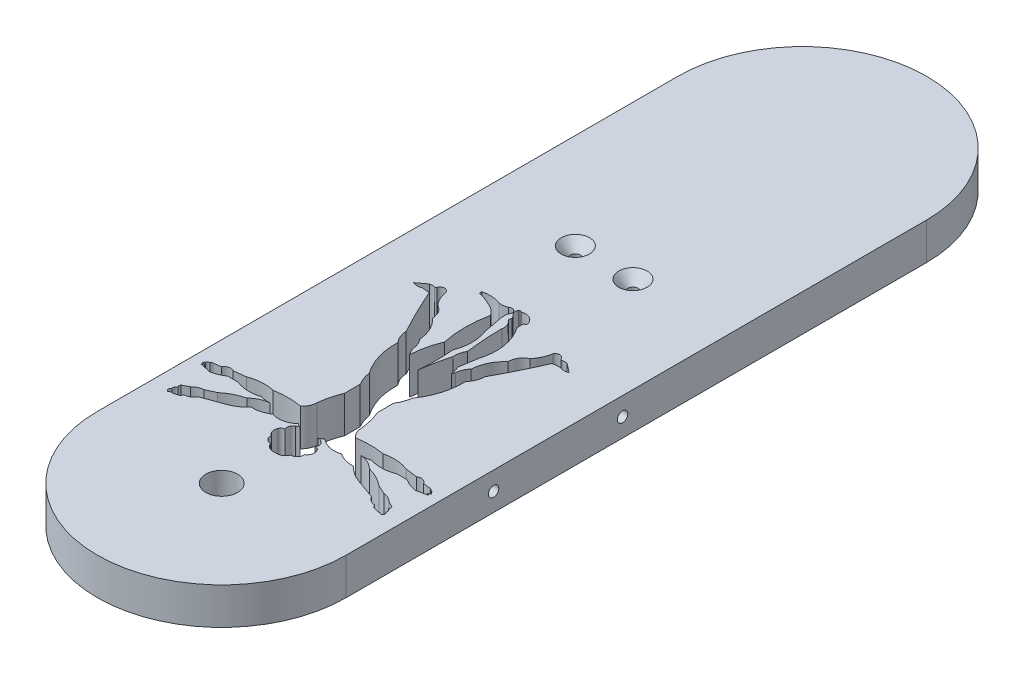
from build123d import *

# Parameters (mm, degrees)
SKETCH1_R                                      = 1.3589
BOSS_EXTRUDE1_DEPTH                            = 10.16
CUT_EXTRUDE1_DEPTH                             = 239.881564797
FILLET1_RADIUS                                 = 34.29
FILLET1_LENGTH                                 = 10.16
CSK_FOR_3_FLAT_HEAD_MACHINE_SCREW1_D           = 2.794
CSK_FOR_3_FLAT_HEAD_MACHINE_SCREW1_CSINK_D     = 7.7978
CSK_FOR_3_FLAT_HEAD_MACHINE_SCREW1_CSINK_ANGLE = 82


with BuildPart() as part:
    # Sketch1 → Boss-Extrude1 (new body)
    # profile 1 of 2: a face of its own
    with BuildSketch(Plane(origin=(0, 0, 0), x_dir=(1, 0, 0), z_dir=(0, 1, 0))):
        with BuildLine():
            Line((34.29, 38.6715), (34.29, 228.6))
            ThreePointArc((34.29, 228.6), (10.043308473, 218.556691527), (0, 194.31))
            Line((0, 194.31), (0, 0))
            Line((0, 0), (34.29, 0))
            Line((34.29, 0), (34.29, 29.9085))
            ThreePointArc((34.29, 29.9085), (29.9085, 34.29), (34.29, 38.6715))
        make_face()
        with Locations(Location((26.3525, 139.7, 0), (0, 0, 270))):
            Circle(SKETCH1_R, mode=Mode.SUBTRACT)
    # profile 2 of 2: a face of its own
    with BuildSketch(Plane(origin=(0, 0, 0), x_dir=(1, 0, 0), z_dir=(0, 1, 0))):
        with BuildLine():
            ThreePointArc((68.58, 194.31), (58.536691527, 218.556691527), (34.29, 228.6))
            Line((34.29, 228.6), (34.29, 38.6715))
            ThreePointArc((34.29, 38.6715), (37.388188362, 37.388188362), (38.6715, 34.29))
            ThreePointArc((38.6715, 34.29), (37.388188362, 31.191811638), (34.29, 29.9085))
            Line((34.29, 29.9085), (34.29, 0))
            Line((34.29, 0), (68.58, 0))
            Line((68.58, 0), (68.58, 194.31))
        make_face()
        with Locations(Location((42.2275, 139.7, 0), (0, 0, 270))):
            Circle(SKETCH1_R, mode=Mode.SUBTRACT)
    extrude(amount=BOSS_EXTRUDE1_DEPTH)

    # Sketch3 → Cut-Extrude1 (cut, through all)
    with BuildSketch(Plane(origin=(0, 10.16, 0), x_dir=(1, 0, 0), z_dir=(0, 1, 0))):
        with BuildLine():
            Line((16.021504242, 53.7464), (10.433504242, 51.746139535))
            ThreePointArc((10.433504242, 51.746139535), (9.495045217, 50.677328074), (8.147504242, 50.222139535))
            Line((8.147504242, 50.222139535), (7.463489192, 49.470887639))
            Line((7.463489192, 49.470887639), (5.873945859, 49.024622033))
            ThreePointArc((5.873945859, 49.024622033), (5.707072801, 49.053386693), (5.569145859, 49.151622033))
            Line((5.569145859, 49.151622033), (4.895207702, 48.796022033))
            ThreePointArc((4.895207702, 48.796022033), (4.436403168, 49.39149158), (4.768207702, 50.066022033))
            ThreePointArc((4.768207702, 50.066022033), (4.775601167, 50.757442266), (5.276207702, 51.234422033))
            ThreePointArc((5.276207702, 51.234422033), (5.092353943, 51.691622033), (5.276207702, 52.148822033))
            Line((5.276207702, 52.148822033), (6.9835177, 53.049675367))
            ThreePointArc((6.9835177, 53.049675367), (8.142471211, 53.875280777), (9.5235177, 54.218075367))
            Line((9.5235177, 54.218075367), (12.061484887, 55.386475367))
            ThreePointArc((12.061484887, 55.386475367), (14.569332906, 57.057729721), (17.395484887, 58.104275367))
            ThreePointArc((17.395484887, 58.104275367), (19.378961401, 59.493262774), (21.713484887, 60.136275367))
            ThreePointArc((21.713484887, 60.136275367), (20.426057844, 60.152651399), (19.173484887, 60.450640578))
            ThreePointArc((19.173484887, 60.450640578), (15.722389818, 59.981073709), (12.315484887, 60.704640578))
            Line((12.315484887, 60.704640578), (9.521484887, 60.704640578))
            ThreePointArc((9.521484887, 60.704640578), (8.587838695, 60.136688343), (7.591084887, 59.688640578))
            Line((7.591084887, 59.688640578), (6.067084887, 59.260776317))
            Line((6.067084887, 59.260776317), (3.019084887, 59.895776317))
            ThreePointArc((3.019084887, 59.895776317), (3.195914546, 60.186310456), (3.51640694, 60.300167267))
            Line((3.51640694, 60.300167267), (2.88140694, 60.452567267))
            ThreePointArc((2.88140694, 60.452567267), (2.945366832, 60.765811085), (3.19890694, 60.960567267))
            ThreePointArc((3.19890694, 60.960567267), (3.453205418, 61.356389398), (3.91010694, 61.468567267))
            ThreePointArc((3.91010694, 61.468567267), (4.094609277, 61.745649642), (4.41810694, 61.824167267))
            Line((4.41810694, 61.824167267), (6.45010694, 62.078167267))
            ThreePointArc((6.45010694, 62.078167267), (7.580686125, 62.953350527), (8.99010694, 62.713167267))
            Line((8.99010694, 62.713167267), (12.29210694, 63.125917267))
            ThreePointArc((12.29210694, 63.125917267), (15.685926927, 63.88221747), (19.15010694, 63.583117267))
            ThreePointArc((19.15010694, 63.583117267), (22.96010694, 63.910226711), (26.77010694, 63.583117267))
            ThreePointArc((26.77010694, 63.583117267), (27.79029106, 64.962924677), (28.19250694, 66.631117267))
            ThreePointArc((28.19250694, 66.631117267), (28.734165641, 69.734202592), (29.71650694, 72.727117267))
            Line((29.71650694, 72.727117267), (29.71650694, 77.045117267))
            ThreePointArc((29.71650694, 77.045117267), (28.80821668, 78.958943902), (28.26870694, 81.007517267))
            ThreePointArc((28.26870694, 81.007517267), (25.703684893, 86.325465298), (24.96670694, 92.183517267))
            ThreePointArc((24.96670694, 92.183517267), (23.859177393, 93.950305448), (23.44270694, 95.993517267))
            ThreePointArc((23.44270694, 95.993517267), (20.258608762, 102.149856934), (17.34670694, 108.439517267))
            Line((17.34670694, 108.439517267), (15.31470694, 108.591917267))
            ThreePointArc((15.31470694, 108.591917267), (14.04470694, 108.357398262), (12.77470694, 108.591917267))
            Line((12.77470694, 108.591917267), (15.31470694, 110.496917267))
            ThreePointArc((15.31470694, 110.496917267), (16.0125091, 110.594649439), (16.710311261, 110.496917267))
            ThreePointArc((16.710311261, 110.496917267), (16.972015844, 110.522087672), (17.186088367, 110.674717267))
            ThreePointArc((17.186088367, 110.674717267), (18.32457594, 111.591285204), (19.571815587, 110.829285204))
            ThreePointArc((19.571815587, 110.829285204), (20.292658051, 108.531387539), (21.603815587, 106.511285204))
            ThreePointArc((21.603815587, 106.511285204), (23.285682997, 104.989263744), (23.889815587, 102.802885204))
            ThreePointArc((23.889815587, 102.802885204), (26.207300587, 99.694785389), (27.191815587, 95.944885204))
            ThreePointArc((27.191815587, 95.944885204), (28.081375094, 94.526951665), (28.461815587, 92.896885204))
            ThreePointArc((28.461815587, 92.896885204), (28.906463415, 91.849209118), (29.477815587, 90.864885204))
            ThreePointArc((29.477815587, 90.864885204), (30.016508912, 94.880986711), (31.255815587, 98.738885204))
            ThreePointArc((31.255815587, 98.738885204), (30.587019857, 105.088885204), (31.255815587, 111.438885204))
            ThreePointArc((31.255815587, 111.438885204), (30.232073511, 112.589050368), (28.969815587, 113.470885204))
            ThreePointArc((28.969815587, 113.470885204), (26.739125093, 114.494377631), (24.397815587, 115.230439197))
            Line((24.397815587, 115.230439197), (24.397815587, 115.865439197))
            ThreePointArc((24.397815587, 115.865439197), (26.961507053, 116.107896957), (29.477815587, 115.560639197))
            ThreePointArc((29.477815587, 115.560639197), (30.639159771, 115.522541543), (31.763815587, 115.814639197))
            ThreePointArc((31.763815587, 115.814639197), (33.343364216, 115.759090569), (33.287815587, 114.17954194))
            ThreePointArc((33.287815587, 114.17954194), (33.21398738, 113.253713572), (33.287815587, 112.327885204))
            Line((33.287815587, 112.327885204), (34.303815587, 106.866885204))
            ThreePointArc((34.303815587, 106.866885204), (35.142981624, 102.421885204), (34.303815587, 97.976885204))
            ThreePointArc((34.303815587, 97.976885204), (34.52576715, 93.150885204), (34.303815587, 88.324885204))
            ThreePointArc((34.303815587, 88.324885204), (34.955124081, 92.418178532), (35.904015587, 96.452885204))
            ThreePointArc((35.904015587, 96.452885204), (36.036099255, 98.100125124), (36.666015587, 99.627885204))
            ThreePointArc((36.666015587, 99.627885204), (36.173233471, 104.697768161), (35.980215587, 109.787885204))
            ThreePointArc((35.980215587, 109.787885204), (35.87468412, 111.331237397), (34.964215587, 112.581885204))
            ThreePointArc((34.964215587, 112.581885204), (34.770176854, 113.089885204), (34.964215587, 113.597885204))
            Line((34.964215587, 113.597885204), (34.456215587, 114.477767014))
            ThreePointArc((34.456215587, 114.477767014), (33.767471806, 115.385081069), (33.948215587, 116.509767014))
            ThreePointArc((33.948215587, 116.509767014), (34.319499568, 116.618050831), (34.659415587, 116.433567014))
            ThreePointArc((34.659415587, 116.433567014), (36.903760339, 116.358297495), (38.367815587, 114.655567014))
            ThreePointArc((38.367815587, 114.655567014), (38.295535075, 114.165099647), (37.83987306, 113.969767014))
            Line((37.83987306, 113.969767014), (37.83987306, 112.125190888))
            ThreePointArc((37.83987306, 112.125190888), (40.343531703, 106.01321627), (39.87187306, 99.425190888))
            Line((39.87187306, 99.425190888), (39.10987306, 94.659728476))
            ThreePointArc((39.10987306, 94.659728476), (39.512473959, 93.404986691), (39.80329306, 92.119728476))
            ThreePointArc((39.80329306, 92.119728476), (39.969651828, 92.504695399), (40.118184413, 92.896885204))
            ThreePointArc((40.118184413, 92.896885204), (40.498624906, 94.526951665), (41.388184413, 95.944885204))
            ThreePointArc((41.388184413, 95.944885204), (42.372699413, 99.694785389), (44.690184413, 102.802885204))
            ThreePointArc((44.690184413, 102.802885204), (45.294317003, 104.989263744), (46.976184413, 106.511285204))
            ThreePointArc((46.976184413, 106.511285204), (48.287341949, 108.531387539), (49.008184413, 110.829285204))
            ThreePointArc((49.008184413, 110.829285204), (50.25542406, 111.591285204), (51.393911633, 110.674717267))
            ThreePointArc((51.393911633, 110.674717267), (51.607984156, 110.522087672), (51.869688739, 110.496917267))
            ThreePointArc((51.869688739, 110.496917267), (52.5674909, 110.594649439), (53.26529306, 110.496917267))
            Line((53.26529306, 110.496917267), (55.80529306, 108.591917267))
            ThreePointArc((55.80529306, 108.591917267), (54.53529306, 108.357398262), (53.26529306, 108.591917267))
            Line((53.26529306, 108.591917267), (51.23329306, 108.439517267))
            ThreePointArc((51.23329306, 108.439517267), (48.321391238, 102.149856934), (45.13729306, 95.993517267))
            ThreePointArc((45.13729306, 95.993517267), (44.720822607, 93.950305448), (43.61329306, 92.183517267))
            ThreePointArc((43.61329306, 92.183517267), (42.876315107, 86.325465298), (40.31129306, 81.007517267))
            ThreePointArc((40.31129306, 81.007517267), (39.77178332, 78.958943902), (38.86349306, 77.045117267))
            Line((38.86349306, 77.045117267), (38.86349306, 72.727117267))
            ThreePointArc((38.86349306, 72.727117267), (39.845834359, 69.734202592), (40.38749306, 66.631117267))
            ThreePointArc((40.38749306, 66.631117267), (40.78970894, 64.962924677), (41.80989306, 63.583117267))
            ThreePointArc((41.80989306, 63.583117267), (45.61989306, 63.910226711), (49.42989306, 63.583117267))
            ThreePointArc((49.42989306, 63.583117267), (52.894073073, 63.88221747), (56.28789306, 63.125917267))
            Line((56.28789306, 63.125917267), (59.58989306, 62.713167267))
            ThreePointArc((59.58989306, 62.713167267), (60.999313875, 62.953350527), (62.12989306, 62.078167267))
            Line((62.12989306, 62.078167267), (64.16189306, 61.824167267))
            ThreePointArc((64.16189306, 61.824167267), (64.485390723, 61.745649642), (64.66989306, 61.468567267))
            ThreePointArc((64.66989306, 61.468567267), (65.126794582, 61.356389398), (65.38109306, 60.960567267))
            ThreePointArc((65.38109306, 60.960567267), (65.634633168, 60.765811085), (65.69859306, 60.452567267))
            Line((65.69859306, 60.452567267), (65.06359306, 60.300167267))
            ThreePointArc((65.06359306, 60.300167267), (65.384085454, 60.186310456), (65.560915113, 59.895776317))
            Line((65.560915113, 59.895776317), (62.512915113, 59.260776317))
            Line((62.512915113, 59.260776317), (60.988915113, 59.688640578))
            ThreePointArc((60.988915113, 59.688640578), (59.992161305, 60.136688343), (59.058515113, 60.704640578))
            Line((59.058515113, 60.704640578), (56.264515113, 60.704640578))
            ThreePointArc((56.264515113, 60.704640578), (52.857610182, 59.981073709), (49.406515113, 60.450640578))
            ThreePointArc((49.406515113, 60.450640578), (48.153942156, 60.152651399), (46.866515113, 60.136275367))
            ThreePointArc((46.866515113, 60.136275367), (49.201038599, 59.493262774), (51.184515113, 58.104275367))
            ThreePointArc((51.184515113, 58.104275367), (54.010667094, 57.057729721), (56.518515113, 55.386475367))
            Line((56.518515113, 55.386475367), (59.0564823, 54.218075367))
            ThreePointArc((59.0564823, 54.218075367), (60.437528789, 53.875280777), (61.5964823, 53.049675367))
            Line((61.5964823, 53.049675367), (63.303792298, 52.148822033))
            ThreePointArc((63.303792298, 52.148822033), (63.487646057, 51.691622033), (63.303792298, 51.234422033))
            ThreePointArc((63.303792298, 51.234422033), (63.804398833, 50.757442266), (63.811792298, 50.066022033))
            ThreePointArc((63.811792298, 50.066022033), (64.143596832, 49.39149158), (63.684792298, 48.796022033))
            Line((63.684792298, 48.796022033), (63.010854141, 49.151622033))
            ThreePointArc((63.010854141, 49.151622033), (62.872927199, 49.053386693), (62.706054141, 49.024622033))
            Line((62.706054141, 49.024622033), (61.116510808, 49.470887639))
            Line((61.116510808, 49.470887639), (60.432495758, 50.222139535))
            ThreePointArc((60.432495758, 50.222139535), (59.084954783, 50.677328074), (58.146495758, 51.746139535))
            Line((58.146495758, 51.746139535), (52.558495758, 53.7464))
            ThreePointArc((52.558495758, 53.7464), (50.29152867, 54.886199369), (48.367495758, 56.5404))
            ThreePointArc((48.367495758, 56.5404), (45.974165819, 56.809288451), (43.795495758, 57.8358))
            ThreePointArc((43.795495758, 57.8358), (40.699732545, 57.666889223), (37.953495758, 59.1058))
            ThreePointArc((37.953495758, 59.1058), (37.384877498, 58.683191325), (36.762994595, 58.3438))
            ThreePointArc((36.762994595, 58.3438), (37.315545426, 58.395003327), (37.778994595, 58.0898))
            ThreePointArc((37.778994595, 58.0898), (38.622271489, 57.140189381), (38.464794595, 55.88))
            ThreePointArc((38.464794595, 55.88), (39.194685695, 55.72762877), (39.624, 55.118))
            ThreePointArc((39.624, 55.118), (39.757513763, 53.693645871), (38.862, 52.578))
            ThreePointArc((38.862, 52.578), (38.440331264, 51.153085144), (37.084, 50.546))
            ThreePointArc((37.084, 50.546), (35.96991675, 49.265319291), (34.29, 49.022))
            ThreePointArc((34.29, 49.022), (32.61008325, 49.265319291), (31.496, 50.546))
            ThreePointArc((31.496, 50.546), (30.139668736, 51.153085144), (29.718, 52.578))
            ThreePointArc((29.718, 52.578), (28.822486237, 53.693645871), (28.956, 55.118))
            ThreePointArc((28.956, 55.118), (29.385314305, 55.72762877), (30.115205405, 55.88))
            ThreePointArc((30.115205405, 55.88), (29.957728511, 57.140189381), (30.801005405, 58.0898))
            ThreePointArc((30.801005405, 58.0898), (31.264454574, 58.395003327), (31.817005405, 58.3438))
            ThreePointArc((31.817005405, 58.3438), (31.195122502, 58.683191325), (30.626504242, 59.1058))
            ThreePointArc((30.626504242, 59.1058), (27.880267455, 57.666889223), (24.784504242, 57.8358))
            ThreePointArc((24.784504242, 57.8358), (22.605834181, 56.809288451), (20.212504242, 56.5404))
            ThreePointArc((20.212504242, 56.5404), (18.28847133, 54.886199369), (16.021504242, 53.7464))
        make_face()
    extrude(amount=-CUT_EXTRUDE1_DEPTH, mode=Mode.SUBTRACT)

    # Fillet1: full round fillet: the end face becomes a half cylinder, R = half its width
    fillet1_face = Plane((34.29, 5.08, 0), x_dir=(0, 1, 0), z_dir=(0, 0, 1))  # on the end face: x along it, z out of the body
    fillet1_slab = fillet1_face.offset(-FILLET1_RADIUS / 2) * Box(FILLET1_LENGTH, 2 * FILLET1_RADIUS, FILLET1_RADIUS, mode=Mode.PRIVATE)  # the body's end, R deep
    fillet1_round = Plane((34.29, 5.08, -34.29), x_dir=(0, 0, 1), z_dir=(0, 1, 0)) * Cylinder(FILLET1_RADIUS, FILLET1_LENGTH, mode=Mode.PRIVATE)  # its axis R under the face
    add(fillet1_slab - fillet1_round, mode=Mode.SUBTRACT)

    # CSK for #3 Flat Head Machine Screw1 (through all)
    with Locations(Plane(origin=(0, 10.16, 0), x_dir=(1, 0, 0), z_dir=(0, 1, 0))):
        with Locations((42.2275, 139.7), (26.3525, 139.7)):
            CounterSinkHole(CSK_FOR_3_FLAT_HEAD_MACHINE_SCREW1_D / 2, CSK_FOR_3_FLAT_HEAD_MACHINE_SCREW1_CSINK_D / 2, counter_sink_angle=CSK_FOR_3_FLAT_HEAD_MACHINE_SCREW1_CSINK_ANGLE)

    # Sketch11 → #6-40 Tapped Hole1 (revolve, cut)
    with BuildSketch(Plane(origin=(0, 5.08, -110.49), x_dir=(0, 0, 1), z_dir=(0, 1, 0))):
        Polygon((0, 0), (0, 9.752295074), (1.4351, 8.89), (1.4351, 0), align=None)
    f_6_40_tapped_hole1 = revolve(axis=Axis((-6.35, 5.08, -110.49), (1, 0, 0)), mode=Mode.SUBTRACT)

    # Mirror2: #6-40 Tapped Hole1 across plane
    add(f_6_40_tapped_hole1.mirror(Plane(origin=(0, 0, -92.71), x_dir=(1, 0, 0), z_dir=(0, 0, -1))), mode=Mode.SUBTRACT)

    # Mirror3: #6-40 Tapped Hole1 across plane
    add(f_6_40_tapped_hole1.mirror(Plane(origin=(34.29, 0, 0), x_dir=(0, 0, 1), z_dir=(1, 0, 0))), mode=Mode.SUBTRACT)

    # Mirror3 copy 1 sketch → Mirror3 copy 1 (revolve, cut)
    with BuildSketch(Plane(origin=(68.58, 5.08, -74.93), x_dir=(0, 0, -1), z_dir=(0, 1, 0))):
        Polygon((0, 0), (0, 9.752295074), (1.4351, 8.89), (1.4351, 0), align=None)
    revolve(axis=Axis((74.93, 5.08, -74.93), (-1, 0, 0)), mode=Mode.SUBTRACT)


solid = part.part
